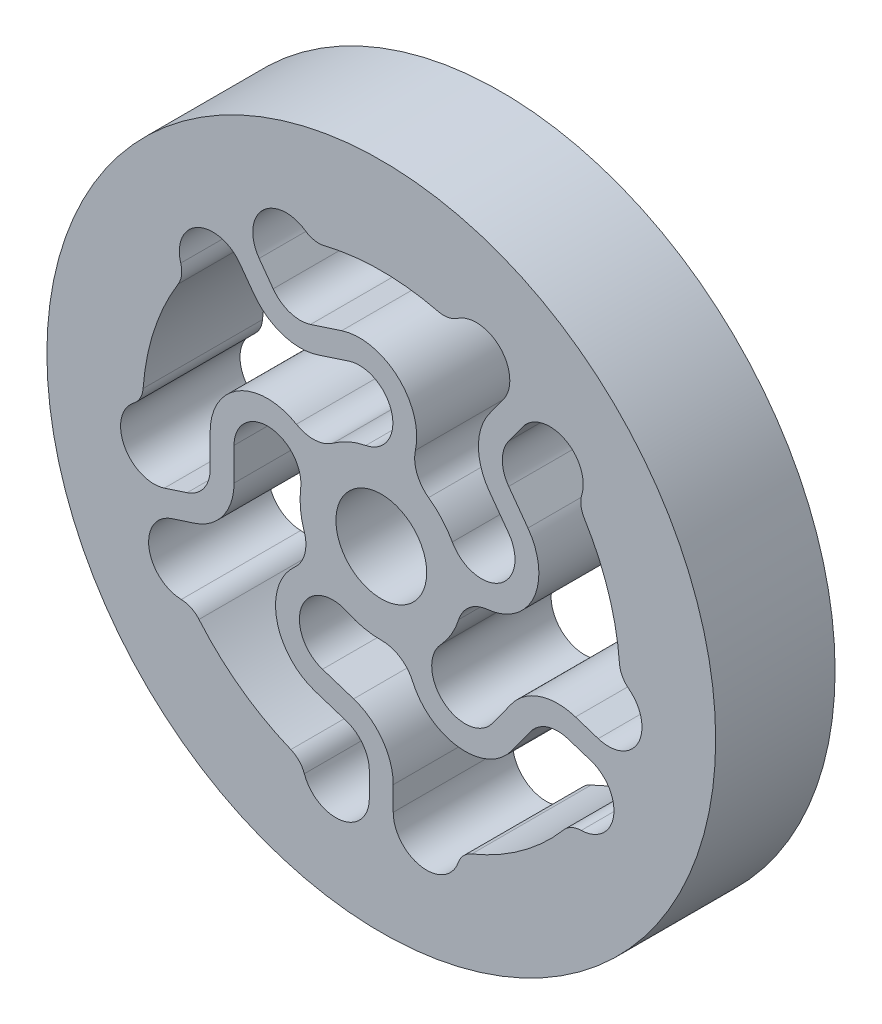
from build123d import *

# Parameters (mm, degrees)
SKETCH1_R             = 3.4
SKETCH1_R_2           = 1.9
BOSS_EXTRUDE1_DEPTH   = 5
SKETCH1_R_3           = 14
SKETCH1_R_4           = 10
BOSS_EXTRUDE1_2_DEPTH = 5
BOSS_EXTRUDE3_START   = -5
BOSS_EXTRUDE3_DEPTH   = 5
CUT_EXTRUDE1_DEPTH    = 21.420577857


with BuildPart() as part:
    # Sketch1 → Boss-Extrude1 (new body)
    with BuildSketch(Plane.XY):
        Circle(SKETCH1_R)
        Circle(SKETCH1_R_2, mode=Mode.SUBTRACT)
    extrude(amount=BOSS_EXTRUDE1_DEPTH)



with BuildPart() as body_2:
    # Sketch1 → Boss-Extrude1 2 (new body)
    with BuildSketch(Plane.XY):
        Circle(SKETCH1_R_3)
        Circle(SKETCH1_R_4, mode=Mode.SUBTRACT)
    extrude(amount=BOSS_EXTRUDE1_2_DEPTH)


with BuildPart() as part_1:
    add(part.part)

    add(body_2.part)  # Boss-Extrude3 merges body 2
    # Sketch3 → Boss-Extrude3 (add)
    with BuildSketch(Plane.XY.offset(5).offset(BOSS_EXTRUDE3_START)):
        with BuildLine():
            Line((-2.461082993, -5.681791735), (-1.158545138, -6.104894644))
            ThreePointArc((-1.158545138, -6.104894644), (0.041583332, -6.976727004), (0.5, -8.387490686))
            ThreePointArc((0.5, -8.387490686), (1.026221783, -9.481342425), (2.209302326, -9.752896146))
            ThreePointArc((2.209302326, -9.752896146), (0, -10), (-2.209302326, -9.752896146))
            ThreePointArc((-2.209302326, -9.752896146), (-0.55013353, -8.758786407), (-1.467484664, -7.055976328))
            Line((-1.467484664, -7.055976328), (-2.770022518, -6.632873419))
            ThreePointArc((-2.770022518, -6.632873419), (-4.377477342, -4.842845432), (-3.62455882, -2.557845453))
            ThreePointArc((-3.62455882, -2.557845453), (-3.203111756, -1.874062431), (-3.226850513, -1.071184282))
            ThreePointArc((-3.226850513, -1.071184282), (-2.53927856, -2.260987482), (-1.43690209, -3.081446476))
            ThreePointArc((-1.43690209, -3.081446476), (-3.331173148, -3.837228711), (-2.461082993, -5.681791735))
        make_face()
        with BuildLine():
            Line((-6.164221523, 0.584858813), (-6.164109969, -0.784674291))
            ThreePointArc((-6.164109969, -0.784674291), (-6.622411723, -2.195475308), (-7.822469175, -3.06740542))
            ThreePointArc((-7.822469175, -3.06740542), (-8.700172525, -3.905890853), (-8.592843468, -5.114982027))
            ThreePointArc((-8.592843468, -5.114982027), (-9.510565163, -3.090169944), (-9.958267397, -0.91263928))
            ThreePointArc((-9.958267397, -0.91263928), (-8.500101497, -2.183405771), (-7.164109966, -0.784755745))
            Line((-7.164109966, -0.784755745), (-7.16422152, 0.584777358))
            ThreePointArc((-7.16422152, 0.584777358), (-5.958534597, 2.666706812), (-3.552705858, 2.656742571))
            ThreePointArc((-3.552705858, 2.656742571), (-2.772155254, 2.467223168), (-2.015908439, 2.73790306))
            ThreePointArc((-2.015908439, 2.73790306), (-2.935007106, 1.716313866), (-3.374656916, 0.414355768))
            ThreePointArc((-3.374656916, 0.414355768), (-4.678810484, 1.982365046), (-6.164221523, 0.584858813))
        make_face()
        with BuildLine():
            Line((-1.348615423, 6.04325436), (-2.651084333, 5.619939262))
            ThreePointArc((-2.651084333, 5.619939262), (-4.134458864, 5.619848642), (-5.334551826, 6.491729879))
            ThreePointArc((-5.334551826, 6.491729879), (-6.403224112, 7.067369122), (-7.519971649, 6.591663402))
            ThreePointArc((-7.519971649, 6.591663402), (-5.877852523, 8.090169944), (-3.945245395, 9.188854051))
            ThreePointArc((-3.945245395, 9.188854051), (-4.703218103, 7.409367429), (-2.960178794, 6.570970605))
            Line((-2.960178794, 6.570970605), (-1.657709884, 6.994285702))
            ThreePointArc((-1.657709884, 6.994285702), (0.694900438, 6.490960879), (1.428865848, 4.199802661))
            ThreePointArc((1.428865848, 4.199802661), (1.489825587, 3.398890206), (1.98095058, 2.763301431))
            ThreePointArc((1.98095058, 2.763301431), (0.725344411, 3.321727786), (-0.648750584, 3.337532424))
            ThreePointArc((-0.648750584, 3.337532424), (0.439509241, 5.062397688), (-1.348615423, 6.04325436))
        make_face()
        with BuildLine():
            Line((5.330731354, 3.150077785), (4.525649744, 4.25798777))
            ThreePointArc((4.525649744, 4.25798777), (4.06717562, 5.66873278), (4.525534832, 7.079515131))
            ThreePointArc((4.525534832, 7.079515131), (4.742762387, 8.273765181), (3.945245395, 9.188854051))
            ThreePointArc((3.945245395, 9.188854051), (5.877852523, 8.090169944), (7.519971649, 6.591663402))
            ThreePointArc((7.519971649, 6.591663402), (5.593352853, 6.762646678), (5.334618858, 4.845838918))
            Line((5.334618858, 4.845838918), (6.139700468, 3.737928933))
            ThreePointArc((6.139700468, 3.737928933), (6.388006686, 1.344927632), (4.435793517, -0.06112178))
            ThreePointArc((4.435793517, -0.06112178), (3.692918104, -0.366593497), (3.240203227, -1.030088854))
            ThreePointArc((3.240203227, -1.030088854), (3.383294606, 0.336626808), (2.973707004, 1.648352709))
            ThreePointArc((2.973707004, 1.648352709), (4.950442134, 1.14636879), (5.330731354, 3.150077785))
        make_face()
        with BuildLine():
            Line((4.643188585, -4.096399222), (5.448089696, -2.988358097))
            ThreePointArc((5.448089696, -2.988358097), (6.648111636, -2.116379111), (8.131486169, -2.116348904))
            ThreePointArc((8.131486169, -2.116348904), (9.334412468, -1.953901025), (9.958267397, -0.91263928))
            ThreePointArc((9.958267397, -0.91263928), (9.510565163, -3.090169944), (8.592843468, -5.114982027))
            ThreePointArc((8.592843468, -5.114982027), (8.160100277, -3.229821928), (6.257154566, -3.576077449))
            Line((6.257154566, -3.576077449), (5.452253454, -4.684118574))
            ThreePointArc((5.452253454, -4.684118574), (3.253104814, -5.659749891), (1.312605313, -4.237577998))
            ThreePointArc((1.312605313, -4.237577998), (0.792523319, -3.625457447), (0.021605145, -3.399931355))
            ThreePointArc((0.021605145, -3.399931355), (1.365646649, -3.113680977), (2.486602586, -2.318794424))
            ThreePointArc((2.486602586, -2.318794424), (2.620032257, -4.353902812), (4.643188585, -4.096399222))
        make_face()
    extrude(amount=BOSS_EXTRUDE3_DEPTH)

    # Sketch4 → Cut-Extrude1 (cut, through all)
    with BuildSketch(Plane.XY.offset(5)):
        with BuildLine():
            Line((0.5, -8.387490686), (0.5, -9.387490686))
            ThreePointArc((0.5, -9.387490686), (1.665239053, -10.767667231), (3.221267568, -9.850364333))
            ThreePointArc((3.221267568, -9.850364333), (3.43999971, -9.49227151), (3.786391015, -9.25544397))
            ThreePointArc((3.786391015, -9.25544397), (3.008147158, -9.536826027), (2.209302326, -9.752896146))
            ThreePointArc((2.209302326, -9.752896146), (1.026221783, -9.481342425), (0.5, -8.387490686))
        make_face()
        with BuildLine():
            Line((-0.5, -8.387490686), (-0.5, -9.387490686))
            ThreePointArc((-0.5, -9.387490686), (-1.665239053, -10.767667231), (-3.221267568, -9.850364333))
            ThreePointArc((-3.221267568, -9.850364333), (-3.43999971, -9.49227151), (-3.786391015, -9.25544397))
            ThreePointArc((-3.786391015, -9.25544397), (-3.008147158, -9.536826027), (-2.209302326, -9.752896146))
            ThreePointArc((-2.209302326, -9.752896146), (-1.026221783, -9.481342425), (-0.5, -8.387490686))
        make_face()
        with BuildLine():
            Line((-7.822469175, -3.06740542), (-8.773525691, -3.376422415))
            ThreePointArc((-8.773525691, -3.376422415), (-9.726072919, -4.911128617), (-8.372826765, -6.107537491))
            ThreePointArc((-8.372826765, -6.107537491), (-7.964668303, -6.204907352), (-7.632391128, -6.461161325))
            ThreePointArc((-7.632391128, -6.461161325), (-8.140491944, -5.807959272), (-8.592843468, -5.114982027))
            ThreePointArc((-8.592843468, -5.114982027), (-8.700172525, -3.905890853), (-7.822469175, -3.06740542))
        make_face()
        with BuildLine():
            Line((-8.131486169, -2.116348904), (-9.082542685, -2.425365898))
            ThreePointArc((-9.082542685, -2.425365898), (-10.755247253, -1.743655712), (-10.363679609, 0.019677532))
            ThreePointArc((-10.363679609, 0.019677532), (-10.090705045, 0.338360929), (-9.97250947, 0.740982371))
            ThreePointArc((-9.97250947, 0.740982371), (-9.999629131, -0.086123358), (-9.958267397, -0.91263928))
            ThreePointArc((-9.958267397, -0.91263928), (-9.334412468, -1.953901025), (-8.131486169, -2.116348904))
        make_face()
        with BuildLine():
            Line((-5.334551826, 6.491729879), (-5.922337078, 7.300746873))
            ThreePointArc((-5.922337078, 7.300746873), (-7.676282694, 7.732422823), (-8.395959091, 6.075698576))
            ThreePointArc((-8.395959091, 6.075698576), (-8.36243543, 5.657427869), (-8.503468148, 5.262226664))
            ThreePointArc((-8.503468148, 5.262226664), (-8.039247865, 5.947309792), (-7.519971649, 6.591663402))
            ThreePointArc((-7.519971649, 6.591663402), (-6.403224112, 7.067369122), (-5.334551826, 6.491729879))
        make_face()
        with BuildLine():
            Line((-4.525534832, 7.079515131), (-5.113320084, 7.888532125))
            ThreePointArc((-5.113320084, 7.888532125), (-4.981869307, 9.690028737), (-3.183838679, 9.862525716))
            ThreePointArc((-3.183838679, 9.862525716), (-2.796398978, 9.701390064), (-2.37695879, 9.71339626))
            ThreePointArc((-2.37695879, 9.71339626), (-3.17196352, 9.483598865), (-3.945245395, 9.188854051))
            ThreePointArc((-3.945245395, 9.188854051), (-4.742762387, 8.273765181), (-4.525534832, 7.079515131))
        make_face()
        with BuildLine():
            Line((4.525534832, 7.079515131), (5.113320084, 7.888532125))
            ThreePointArc((5.113320084, 7.888532125), (4.981869307, 9.690028737), (3.183838679, 9.862525716))
            ThreePointArc((3.183838679, 9.862525716), (2.796398978, 9.701390064), (2.37695879, 9.71339626))
            ThreePointArc((2.37695879, 9.71339626), (3.17196352, 9.483598865), (3.945245395, 9.188854051))
            ThreePointArc((3.945245395, 9.188854051), (4.742762387, 8.273765181), (4.525534832, 7.079515131))
        make_face()
        with BuildLine():
            Line((5.334551826, 6.491729879), (5.922337078, 7.300746873))
            ThreePointArc((5.922337078, 7.300746873), (7.676282694, 7.732422823), (8.395959091, 6.075698576))
            ThreePointArc((8.395959091, 6.075698576), (8.36243543, 5.657427869), (8.503468148, 5.262226664))
            ThreePointArc((8.503468148, 5.262226664), (8.039247865, 5.947309792), (7.519971649, 6.591663402))
            ThreePointArc((7.519971649, 6.591663402), (6.403224112, 7.067369122), (5.334551826, 6.491729879))
        make_face()
        with BuildLine():
            Line((8.131486169, -2.116348904), (9.082542685, -2.425365898))
            ThreePointArc((9.082542685, -2.425365898), (10.755247253, -1.743655712), (10.363679609, 0.019677532))
            ThreePointArc((10.363679609, 0.019677532), (10.090705045, 0.338360929), (9.97250947, 0.740982371))
            ThreePointArc((9.97250947, 0.740982371), (9.999629131, -0.086123358), (9.958267397, -0.91263928))
            ThreePointArc((9.958267397, -0.91263928), (9.334412468, -1.953901025), (8.131486169, -2.116348904))
        make_face()
        with BuildLine():
            Line((7.822469175, -3.06740542), (8.773525691, -3.376422415))
            ThreePointArc((8.773525691, -3.376422415), (9.726072919, -4.911128617), (8.372826765, -6.107537491))
            ThreePointArc((8.372826765, -6.107537491), (7.964668303, -6.204907352), (7.632391128, -6.461161325))
            ThreePointArc((7.632391128, -6.461161325), (8.140491944, -5.807959272), (8.592843468, -5.114982027))
            ThreePointArc((8.592843468, -5.114982027), (8.700172525, -3.905890853), (7.822469175, -3.06740542))
        make_face()
    extrude(amount=-CUT_EXTRUDE1_DEPTH, mode=Mode.SUBTRACT)


solid = part_1.part
